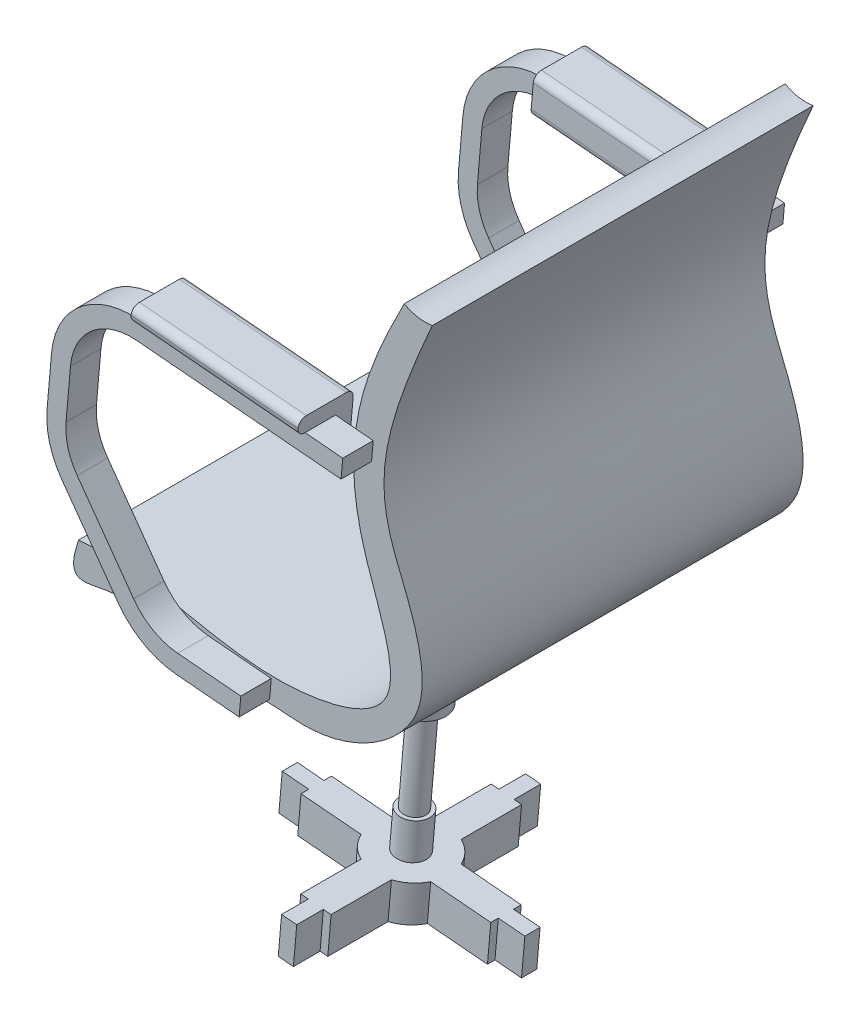
from build123d import *

# Parameters (mm, degrees)
BOSS_EXTRUDE1_DEPTH = 50
BOSS_EXTRUDE2_DEPTH = 4
BOSS_EXTRUDE3_DEPTH = 22
BOSS_EXTRUDE4_DEPTH = 5
SKETCH11_R          = 2
SKETCH11_R_2        = 1.5
BOSS_EXTRUDE5_DEPTH = 5
BOSS_EXTRUDE6_REACH = 152.645
SKETCH12_R          = 1.5
SKETCH13_R          = 3
BOSS_EXTRUDE7_DEPTH = 18
SCALE3_SCALE        = 8


with BuildPart() as part:
    # Sketch2 → Boss-Extrude1 (new body)
    with BuildSketch(Plane.XY):
        with BuildLine():
            add(Edge.make_bspline(
                [(-70.332514526, -37.78540094), (-77.519447225, -54.019976011), (-77.855352948, -60.202482719), (-72.362020496, -73.14354919), (-70.363821929, -80.072800281), (-76.029146674, -88.787219469), (-83.306711166, -92.159452906), (-95.089402427, -90.924210045), (-101.812980865, -91.718471048), (-113.565446987, -87.897914786), (-119.066217404, -92.249573441), (-116.782186256, -85.402087302)],
                knots=[0, 0, 0, 0, 0.246326858, 0.27634663, 0.434809482, 0.461410697, 0.619876185, 0.661403784, 0.852766359, 0.884374783, 1, 1, 1, 1], degree=3))
            add(Edge.make_bspline(
                [(-74.011529837, -37.140625061), (-79.593680133, -47.943899884), (-84.079109706, -60.793013502), (-71.745156629, -84.690033856), (-95.561503485, -90.833797115), (-106.851390249, -84.223467281), (-116.782186256, -85.402087302)],
                knots=[0, 0, 0, 0, 0.357318521, 0.5357707, 0.679014553, 1, 1, 1, 1], degree=3))
            add(Edge.make_bspline(
                [(-74.011529837, -37.140625061), (-72.347305553, -38.09354545), (-70.332514526, -37.78540094)],
                knots=[0, 0, 0, 1, 1, 1], degree=2))
        make_face()
    extrude(amount=-BOSS_EXTRUDE1_DEPTH)

    # Sketch3 → Boss-Extrude2 (add)
    with BuildSketch(Plane(origin=(0, 0, -50), x_dir=(-1, 0, 0), z_dir=(0, 0, -1))):
        with BuildLine():
            Line((78.307445966, -57.226228534), (105.162043656, -54.876721046))
            ThreePointArc((105.162043656, -54.876721046), (111.001592832, -56.717915613), (113.828856489, -62.149021599))
            Line((113.828856489, -62.149021599), (114.408744086, -68.777069481))
            ThreePointArc((114.408744086, -68.777069481), (114.154519646, -71.589425674), (112.93901575, -74.138254366))
            Line((112.93901575, -74.138254366), (105.54617081, -84.441204047))
            ThreePointArc((105.54617081, -84.441204047), (103.006304618, -86.728440647), (99.743598593, -87.746831994))
            Line((99.743598593, -87.746831994), (91.470077283, -88.470681984))
            Line((91.470077283, -88.470681984), (91.687969827, -90.96116845))
            Line((91.687969827, -90.96116845), (99.961491137, -90.23731846))
            ThreePointArc((99.961491137, -90.23731846), (104.243792794, -88.900679817), (107.577367171, -85.898681779))
            Line((107.577367171, -85.898681779), (114.970212111, -75.595732099))
            ThreePointArc((114.970212111, -75.595732099), (116.565560975, -72.250394441), (116.899230552, -68.559176937))
            Line((116.899230552, -68.559176937), (116.319342955, -61.931129055))
            ThreePointArc((116.319342955, -61.931129055), (112.608559406, -54.802802449), (104.944151113, -52.386234579))
            Line((104.944151113, -52.386234579), (78.089553423, -54.735742067))
            Line((78.089553423, -54.735742067), (78.307445966, -57.226228534))
        make_face()
    boss_extrude2 = extrude(amount=BOSS_EXTRUDE2_DEPTH)

    # Sketch5 → Boss-Extrude3 (add)
    with BuildSketch(Plane(origin=(-99.601314326, 8.714114301, 0), x_dir=(0, 0, -1), z_dir=(0.9961945865661667, -0.08715701748146523, 0))):
        with BuildLine():
            Line((53.998099601, -61.350034037), (49.949494416, -61.350034037))
            Line((49.949494416, -61.350034037), (49.949494416, -63.830635766))
            Line((49.949494416, -63.830635766), (49.949494416, -64.413086704))
            Line((49.949494416, -64.413086704), (48.775870618, -64.413086704))
            ThreePointArc((48.775870618, -64.413086704), (48.068763837, -64.120193485), (47.775870618, -63.413086704))
            Line((47.775870618, -63.413086704), (47.775870618, -60.287201783))
            ThreePointArc((47.775870618, -60.287201783), (48.068763837, -59.580095002), (48.775870618, -59.287201783))
            Line((48.775870618, -59.287201783), (54.009885492, -59.287201783))
            ThreePointArc((54.009885492, -59.287201783), (54.716992273, -59.580095002), (55.009885492, -60.287201783))
            Line((55.009885492, -60.287201783), (55.009885492, -60.350034037))
            ThreePointArc((55.009885492, -60.350034037), (54.716992273, -61.057140818), (54.009885492, -61.350034037))
            Line((54.009885492, -61.350034037), (53.998099601, -61.350034037))
        make_face()
    boss_extrude3 = extrude(amount=BOSS_EXTRUDE3_DEPTH)

    # Mirror1: Boss-Extrude2, Boss-Extrude3 across plane
    add(boss_extrude2.mirror(Plane(origin=(0, 0, -25), x_dir=(1, 0, 0), z_dir=(0, 0, -1))))
    add(boss_extrude3.mirror(Plane(origin=(0, 0, -25), x_dir=(1, 0, 0), z_dir=(0, 0, -1))))

    # Sketch12 → Boss-Extrude6 (add, up to next)
    with BuildSketch(Plane(origin=(-11.268286906, -128.795210529, 0), x_dir=(0.9961945865661667, -0.0871570174814653, 0), z_dir=(0.0871570174814653, 0.9961945865661667, 0)), mode=Mode.PRIVATE) as boss_extrude6_sk1:
        with Locations(Location((-89.051628322, 27.307542158, 0), (0, 0, 180))):
            Circle(SKETCH12_R)
    boss_extrude6_tool1 = extrude(boss_extrude6_sk1.sketch, amount=BOSS_EXTRUDE6_REACH, mode=Mode.PRIVATE) - part.part
    add(boss_extrude6_tool1.solids().sort_by_distance((-99.981037, -121.033736, -27.307542))[0])

    # Sketch13 → Boss-Extrude7 (add)
    with BuildSketch(Plane(origin=(-8.594228711, -98.231035949, 0), x_dir=(0.9961945865661666, -0.08715701748146568, 0), z_dir=(-0.08715701748146568, -0.9961945865661666, 0))):
        with Locations(Location((-89.051628322, -27.307542158, 0), (0, 0, 180))):
            Circle(SKETCH13_R)
    extrude(amount=BOSS_EXTRUDE7_DEPTH)


with BuildPart() as body_2:
    # Sketch8 → Boss-Extrude4 (new body)
    with BuildSketch(Plane(origin=(-12.139857081, -138.757156394, 0), x_dir=(0.9961945865661667, -0.08715701748146525, 0), z_dir=(0.08715701748146525, 0.9961945865661667, 0))):
        with BuildLine():
            Line((-84.469052627, 29.307542158), (-76.551628322, 29.307542158))
            Line((-76.551628322, 29.307542158), (-76.551628322, 28.294966324))
            Line((-76.551628322, 28.294966324), (-73.051628322, 28.294966324))
            Line((-73.051628322, 28.294966324), (-73.051628322, 26.294966324))
            Line((-73.051628322, 26.294966324), (-76.551628322, 26.294966324))
            Line((-76.551628322, 26.294966324), (-76.551628322, 25.307542158))
            Line((-76.551628322, 25.307542158), (-84.469052627, 25.307542158))
            ThreePointArc((-84.469052627, 25.307542158), (-85.516094416, 23.772008252), (-87.051628322, 22.724966463))
            Line((-87.051628322, 22.724966463), (-87.051628322, 14.807542158))
            Line((-87.051628322, 14.807542158), (-88.064204156, 14.807542158))
            Line((-88.064204156, 14.807542158), (-88.064204156, 11.307542158))
            Line((-88.064204156, 11.307542158), (-90.064204156, 11.307542158))
            Line((-90.064204156, 11.307542158), (-90.064204156, 14.807542158))
            Line((-90.064204156, 14.807542158), (-91.051628322, 14.807542158))
            Line((-91.051628322, 14.807542158), (-91.051628322, 22.724966463))
            ThreePointArc((-91.051628322, 22.724966463), (-92.587162228, 23.772008252), (-93.634204017, 25.307542158))
            Line((-93.634204017, 25.307542158), (-101.551628322, 25.307542158))
            Line((-101.551628322, 25.307542158), (-101.551628322, 26.320117992))
            Line((-101.551628322, 26.320117992), (-105.051628322, 26.320117992))
            Line((-105.051628322, 26.320117992), (-105.051628322, 28.320117992))
            Line((-105.051628322, 28.320117992), (-101.551628322, 28.320117992))
            Line((-101.551628322, 28.320117992), (-101.551628322, 29.307542158))
            Line((-101.551628322, 29.307542158), (-93.634204017, 29.307542158))
            ThreePointArc((-93.634204017, 29.307542158), (-92.587162228, 30.843076064), (-91.051628322, 31.890117853))
            Line((-91.051628322, 31.890117853), (-91.051628322, 39.807542158))
            Line((-91.051628322, 39.807542158), (-90.039052488, 39.807542158))
            Line((-90.039052488, 39.807542158), (-90.039052488, 43.307542158))
            Line((-90.039052488, 43.307542158), (-88.039052488, 43.307542158))
            Line((-88.039052488, 43.307542158), (-88.039052488, 39.807542158))
            Line((-88.039052488, 39.807542158), (-87.051628322, 39.807542158))
            Line((-87.051628322, 39.807542158), (-87.051628322, 31.890117853))
            ThreePointArc((-87.051628322, 31.890117853), (-85.516094416, 30.843076064), (-84.469052627, 29.307542158))
        make_face()
    extrude(amount=BOSS_EXTRUDE4_DEPTH)

    # Sketch11 → Boss-Extrude5 (add)
    with BuildSketch(Plane(origin=(-11.704071993, -133.776183462, 0), x_dir=(0.9961945865661667, -0.08715701748146527, 0), z_dir=(0.08715701748146527, 0.9961945865661667, 0))):
        with Locations(Location((-89.051628322, 27.307542158, 0), (0, 0, 180))):
            Circle(SKETCH11_R)
        with Locations(Location((-89.051628322, 27.307542158, 0), (0, 0, 180))):
            Circle(SKETCH11_R_2, mode=Mode.SUBTRACT)
    extrude(amount=BOSS_EXTRUDE5_DEPTH)


with BuildPart() as part_1:
    # Scale3: scaled about (0, 0, 0)
    add(part.part.scale(SCALE3_SCALE))


with BuildPart() as body_2_1:
    # Scale3: scaled about (0, 0, 0)
    add(body_2.part.scale(SCALE3_SCALE))


solid = Compound([part_1.part, body_2_1.part])
